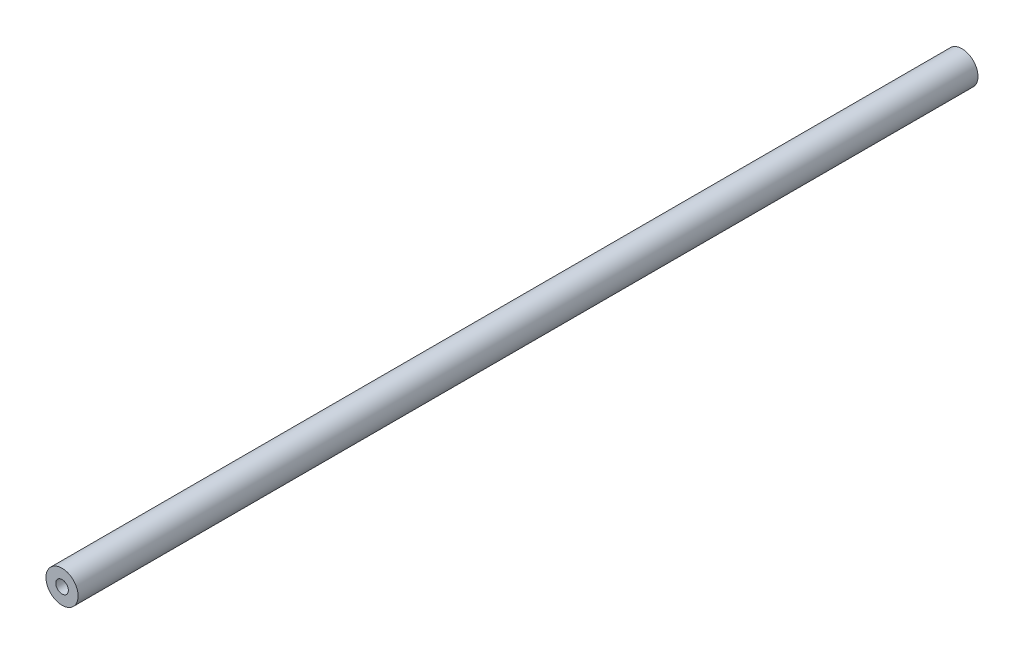
from build123d import *

# Parameters (mm, degrees)
SKETCH1_R           = 6.35
BOSS_EXTRUDE1_DEPTH = 177.8
SKETCH3_R           = 2.4892
CUT_EXTRUDE1_DEPTH  = 19.05


with BuildPart() as part:
    # Sketch1 → Boss-Extrude1 (new, symmetric)
    with BuildSketch(Plane.XY):
        Circle(SKETCH1_R)
    extrude(amount=BOSS_EXTRUDE1_DEPTH, both=True)

    # Sketch3 → Cut-Extrude1 (cut)
    with BuildSketch(Plane.XY.offset(177.8)):
        Circle(SKETCH3_R)
    cut_extrude1 = extrude(amount=-CUT_EXTRUDE1_DEPTH, mode=Mode.SUBTRACT)

    # Mirror1: Cut-Extrude1 across plane
    add(cut_extrude1.mirror(Plane.XY), mode=Mode.SUBTRACT)


solid = part.part
